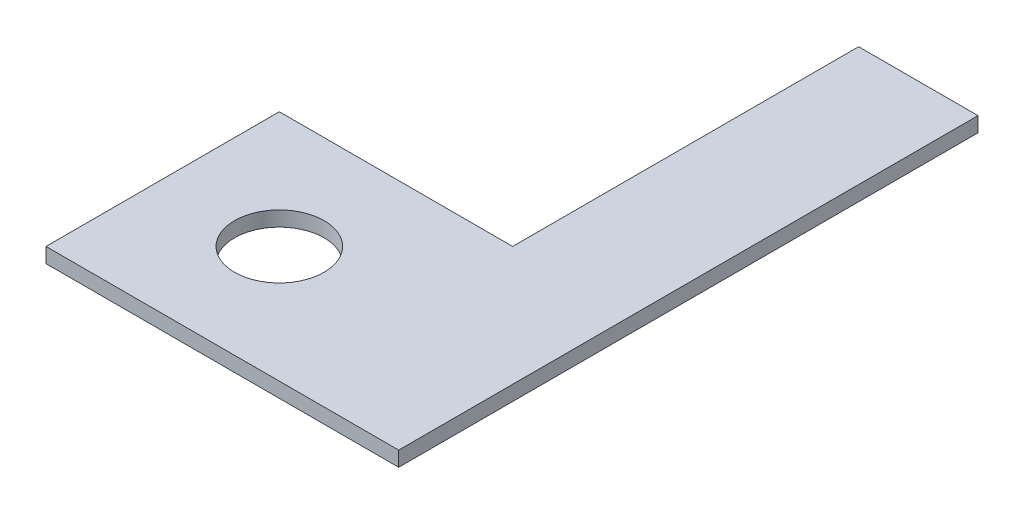
from build123d import *

# Parameters (mm, degrees)
SKETCH1_W           = 63.27
SKETCH1_H           = 63.27
BOSS_EXTRUDE1_DEPTH = 2
SKETCH2_R           = 6
CUT_EXTRUDE1_DEPTH  = 2
SKETCH3_W           = 16
SKETCH3_H           = 62
BOSS_EXTRUDE2_DEPTH = 2
SKETCH4_W           = 16
SKETCH4_H           = 63.27
CUT_EXTRUDE2_DEPTH  = 10
SKETCH5_W           = 47.27
SKETCH5_H           = 16
CUT_EXTRUDE3_DEPTH  = 10
SKETCH6_W           = 31.27
SKETCH6_H           = 16
CUT_EXTRUDE4_DEPTH  = 10


with BuildPart() as part:
    # Sketch1 → Boss-Extrude1 (new body)
    with BuildSketch(Plane(origin=(0, 0, 0), x_dir=(1, 0, 0), z_dir=(0, 1, 0))):
        Rectangle(SKETCH1_W, SKETCH1_H)
    extrude(amount=BOSS_EXTRUDE1_DEPTH)

    # Sketch2 → Cut-Extrude1 (cut)
    with BuildSketch(Plane(origin=(0, 2, 0), x_dir=(1, 0, 0), z_dir=(0, 1, 0))):
        with Locations(Location((0, 0, 0), (0, 0, 270))):
            Circle(SKETCH2_R)
    extrude(amount=-CUT_EXTRUDE1_DEPTH, mode=Mode.SUBTRACT)

    # Sketch3 → Boss-Extrude2 (add)
    with BuildSketch(Plane(origin=(0, 2, 0), x_dir=(1, 0, 0), z_dir=(0, 1, 0))):
        with Locations((23.635, 31)):
            Rectangle(SKETCH3_W, SKETCH3_H)
    extrude(amount=-BOSS_EXTRUDE2_DEPTH)

    # Sketch4 → Cut-Extrude2 (cut)
    with BuildSketch(Plane.XZ):
        with Locations((-23.635, 0)):
            Rectangle(SKETCH4_W, SKETCH4_H)
    extrude(amount=-CUT_EXTRUDE2_DEPTH, mode=Mode.SUBTRACT)

    # Sketch5 → Cut-Extrude3 (cut)
    with BuildSketch(Plane.XZ):
        with Locations((8, 23.635)):
            Rectangle(SKETCH5_W, SKETCH5_H)
    extrude(amount=-CUT_EXTRUDE3_DEPTH, mode=Mode.SUBTRACT)

    # Sketch6 → Cut-Extrude4 (cut)
    with BuildSketch(Plane.XZ):
        with Locations((0, -23.635)):
            Rectangle(SKETCH6_W, SKETCH6_H)
    extrude(amount=-CUT_EXTRUDE4_DEPTH, mode=Mode.SUBTRACT)


solid = part.part
